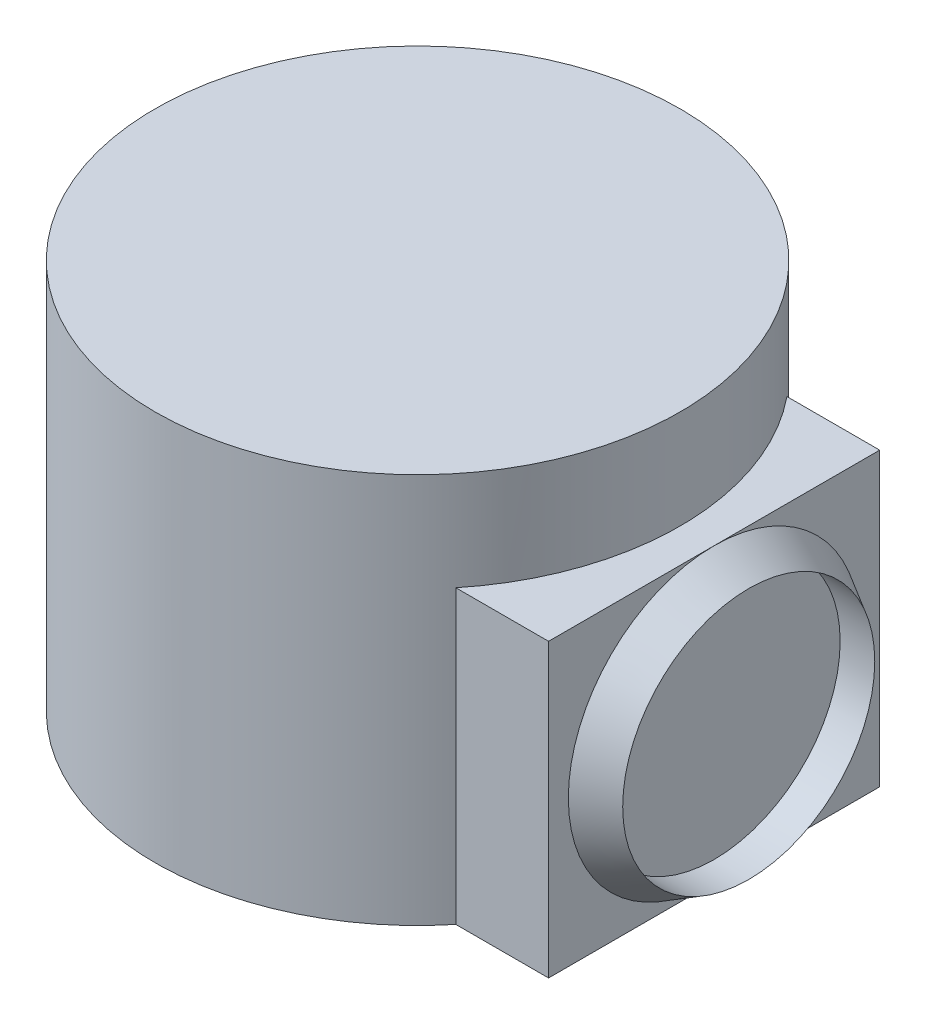
from build123d import *

# Parameters (mm, degrees)
SKETCH1_R           = 132.8125
BOSS_EXTRUDE1_DEPTH = 147.5
SKETCH2_W           = 167.5
SKETCH2_H           = 147.5
BOSS_EXTRUDE2_DEPTH = 150
SKETCH5_R           = 132.8125
BOSS_EXTRUDE3_DEPTH = 50


with BuildPart() as part:
    # Sketch1 → Boss-Extrude1 (new body)
    with BuildSketch(Plane(origin=(0, 0, 0), x_dir=(1, 0, 0), z_dir=(0, 1, 0))):
        with Locations(Location((0, 0, 0), (0, 0, 270))):
            Circle(SKETCH1_R)
    extrude(amount=BOSS_EXTRUDE1_DEPTH)

    # Sketch2 → Boss-Extrude2 (add)
    with BuildSketch(Plane(origin=(0, 0, 0), x_dir=(0, 0, -1), z_dir=(1, 0, 0))):
        with Locations((0, 73.75)):
            Rectangle(SKETCH2_W, SKETCH2_H)
    extrude(amount=BOSS_EXTRUDE2_DEPTH)

    # Sketch4 → Revolve1 (revolve)
    with BuildSketch(Plane.XY, mode=Mode.PRIVATE) as revolve1_sk:
        Polygon((150, 0), (150, 10), (167.5, 10), align=None)
    revolve(revolve1_sk.sketch.rotate(Axis((150, 73.75, 0), (1, 0, 0)), 270), axis=Axis((150, 73.75, 0), (1, 0, 0)))

    # Sketch5 → Boss-Extrude3 (add)
    with BuildSketch(Plane(origin=(0, 147.5, 0), x_dir=(1, 0, 0), z_dir=(0, 1, 0))):
        with Locations(Location((0, 0, 0), (0, 0, 39.093534815))):
            Circle(SKETCH5_R)
    extrude(amount=BOSS_EXTRUDE3_DEPTH)


solid = part.part
